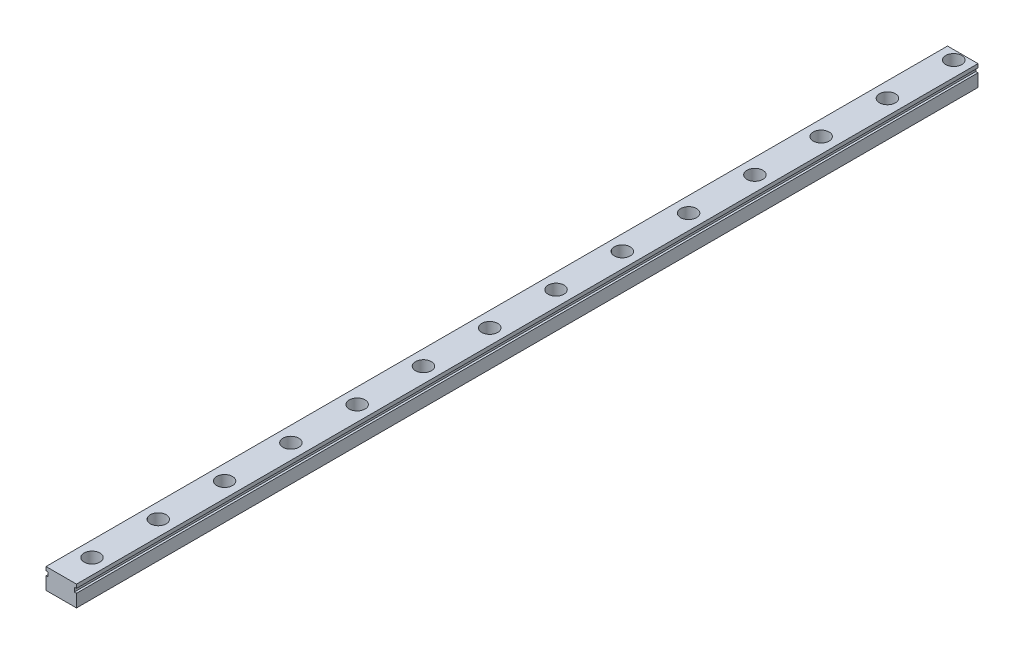
from build123d import *

# Parameters (mm, degrees)
SKETCH1_W           = 11.5
SKETCH1_H           = 7.8
BOSS_EXTRUDE1_DEPTH = 340
SKETCH2_W           = 0.835250229
SKETCH2_H           = 1.6
CUT_EXTRUDE1_DEPTH  = 341.070981561
SKETCH3_R           = 3
CUT_EXTRUDE2_DEPTH  = 4.7
SKETCH4_R           = 1.7
CUT_EXTRUDE3_DEPTH  = 341.081096946


with BuildPart() as part:
    # Sketch1 → Boss-Extrude1 (new body)
    with BuildSketch(Plane.XY):
        Rectangle(SKETCH1_W, SKETCH1_H)
    extrude(amount=BOSS_EXTRUDE1_DEPTH)

    # Sketch2 → Cut-Extrude1 (cut, through all)
    with BuildSketch(Plane.XY.offset(340)):
        with Locations((5.332374886, 1.7)):
            Rectangle(SKETCH2_W, SKETCH2_H)
        with Locations((-5.332374886, 1.7)):
            Rectangle(SKETCH2_W, SKETCH2_H)
    extrude(amount=-CUT_EXTRUDE1_DEPTH, mode=Mode.SUBTRACT)

    # Sketch3 → Cut-Extrude2 (cut)
    with BuildSketch(Plane(origin=(0, 3.9, 0), x_dir=(1, 0, 0), z_dir=(0, 1, 0))):
        with Locations(Location((0, -328.4, 0), (0, 0, 270))):
            Circle(SKETCH3_R)
        with Locations(Location((0, -303.4, 0), (0, 0, 270))):
            Circle(SKETCH3_R)
        with Locations(Location((0, -278.4, 0), (0, 0, 270))):
            Circle(SKETCH3_R)
        with Locations(Location((0, -253.4, 0), (0, 0, 270))):
            Circle(SKETCH3_R)
        with Locations(Location((0, -228.4, 0), (0, 0, 270))):
            Circle(SKETCH3_R)
        with Locations(Location((0, -203.4, 0), (0, 0, 270))):
            Circle(SKETCH3_R)
        with Locations(Location((0, -178.4, 0), (0, 0, 270))):
            Circle(SKETCH3_R)
        with Locations(Location((0, -153.4, 0), (0, 0, 270))):
            Circle(SKETCH3_R)
        with Locations(Location((0, -128.4, 0), (0, 0, 270))):
            Circle(SKETCH3_R)
        with Locations(Location((0, -103.4, 0), (0, 0, 270))):
            Circle(SKETCH3_R)
        with Locations(Location((0, -78.4, 0), (0, 0, 270))):
            Circle(SKETCH3_R)
        with Locations(Location((0, -53.4, 0), (0, 0, 270))):
            Circle(SKETCH3_R)
        with Locations(Location((0, -28.4, 0), (0, 0, 270))):
            Circle(SKETCH3_R)
        with Locations(Location((0, -3.4, 0), (0, 0, 270))):
            Circle(SKETCH3_R)
        with Locations((0, 21.6)):
            Circle(SKETCH3_R)
        with Locations((0, 46.6)):
            Circle(SKETCH3_R)
        with Locations((0, 71.6)):
            Circle(SKETCH3_R)
        with Locations((0, 96.6)):
            Circle(SKETCH3_R)
        with Locations((0, 121.6)):
            Circle(SKETCH3_R)
        with Locations((0, 146.6)):
            Circle(SKETCH3_R)
        with Locations((0, 171.6)):
            Circle(SKETCH3_R)
        with Locations((0, 196.6)):
            Circle(SKETCH3_R)
        with Locations((0, 221.6)):
            Circle(SKETCH3_R)
        with Locations((0, 246.6)):
            Circle(SKETCH3_R)
        with Locations((0, 271.6)):
            Circle(SKETCH3_R)
    extrude(amount=-CUT_EXTRUDE2_DEPTH, mode=Mode.SUBTRACT)

    # Sketch4 → Cut-Extrude3 (cut, through all)
    with BuildSketch(Plane(origin=(0, -0.8, 0), x_dir=(1, 0, 0), z_dir=(0, 1, 0))):
        with Locations(Location((0, -328.4, 0), (0, 0, 270))):
            Circle(SKETCH4_R)
        with Locations(Location((0, -303.4, 0), (0, 0, 270))):
            Circle(SKETCH4_R)
        with Locations(Location((0, -278.4, 0), (0, 0, 270))):
            Circle(SKETCH4_R)
        with Locations(Location((0, -253.4, 0), (0, 0, 270))):
            Circle(SKETCH4_R)
        with Locations(Location((0, -228.4, 0), (0, 0, 270))):
            Circle(SKETCH4_R)
        with Locations(Location((0, -203.4, 0), (0, 0, 270))):
            Circle(SKETCH4_R)
        with Locations(Location((0, -178.4, 0), (0, 0, 270))):
            Circle(SKETCH4_R)
        with Locations(Location((0, -153.4, 0), (0, 0, 270))):
            Circle(SKETCH4_R)
        with Locations(Location((0, -128.4, 0), (0, 0, 270))):
            Circle(SKETCH4_R)
        with Locations(Location((0, -103.4, 0), (0, 0, 270))):
            Circle(SKETCH4_R)
        with Locations(Location((0, -78.4, 0), (0, 0, 270))):
            Circle(SKETCH4_R)
        with Locations(Location((0, -53.4, 0), (0, 0, 270))):
            Circle(SKETCH4_R)
        with Locations(Location((0, -28.4, 0), (0, 0, 270))):
            Circle(SKETCH4_R)
        with Locations(Location((0, -3.4, 0), (0, 0, 270))):
            Circle(SKETCH4_R)
        with Locations((0, 21.6)):
            Circle(SKETCH4_R)
        with Locations((0, 46.6)):
            Circle(SKETCH4_R)
        with Locations((0, 71.6)):
            Circle(SKETCH4_R)
        with Locations((0, 96.6)):
            Circle(SKETCH4_R)
        with Locations((0, 121.6)):
            Circle(SKETCH4_R)
        with Locations((0, 146.6)):
            Circle(SKETCH4_R)
        with Locations((0, 171.6)):
            Circle(SKETCH4_R)
        with Locations((0, 196.6)):
            Circle(SKETCH4_R)
        with Locations((0, 221.6)):
            Circle(SKETCH4_R)
        with Locations((0, 246.6)):
            Circle(SKETCH4_R)
        with Locations((0, 271.6)):
            Circle(SKETCH4_R)
    extrude(amount=-CUT_EXTRUDE3_DEPTH, mode=Mode.SUBTRACT)


solid = part.part
